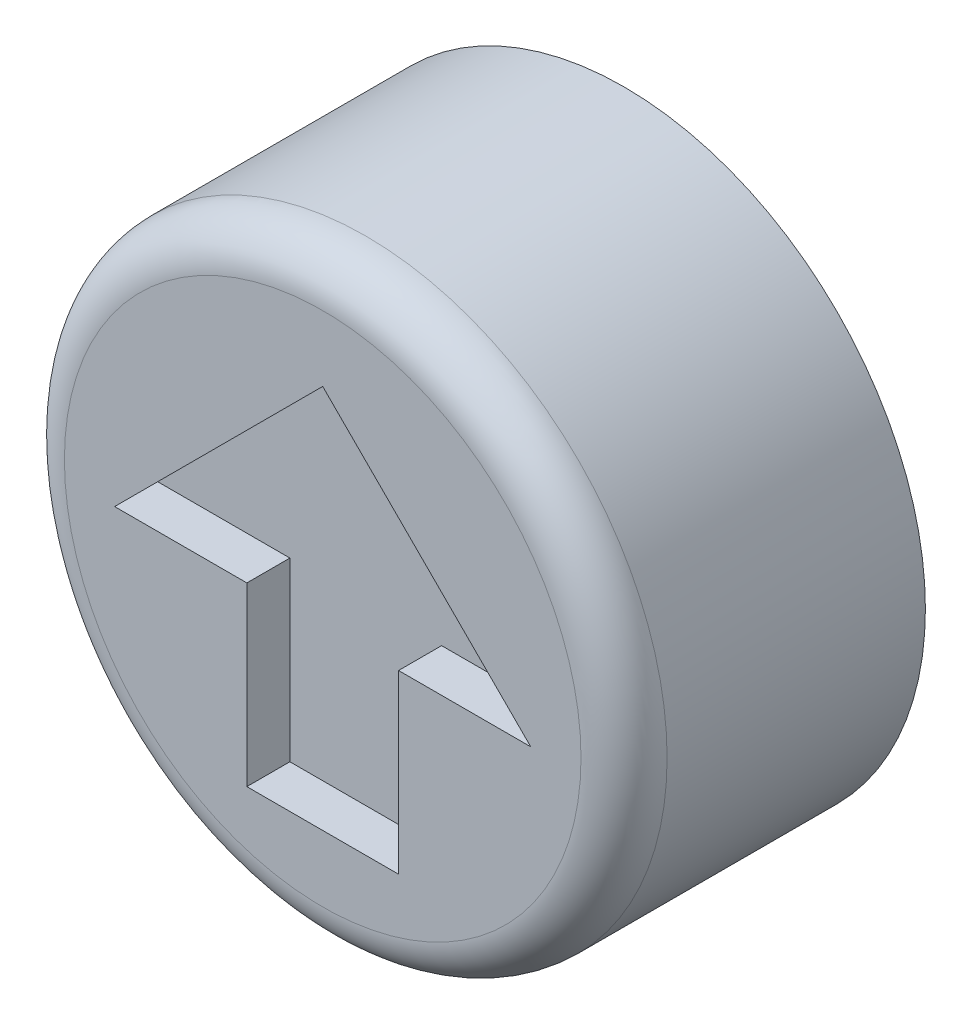
from build123d import *

# Parameters (mm, degrees)
SKETCH_1_R          = 7
SKETCH_1_R_2        = 1.6
EXTRUDE_1_DEPTH     = 5
SKETCH_2_R          = 7
EXTRUDE_2_DEPTH     = 2
FILLET_1_R          = 1
CUT_EXTRUDE_1_DEPTH = 1


with BuildPart() as part:
    # 草图1 → 凸台-拉伸1 (new body)
    with BuildSketch(Plane.XY):
        Circle(SKETCH_1_R)
        Circle(SKETCH_1_R_2, mode=Mode.SUBTRACT)
    extrude(amount=EXTRUDE_1_DEPTH)

    # 草图2 → 凸台-拉伸2 (add)
    with BuildSketch(Plane.XY.offset(5)):
        Circle(SKETCH_2_R)
    extrude(amount=EXTRUDE_2_DEPTH)

    # 圆角1
    fillet_1_edges = [part.edges().sort_by_distance(p)[0] for p in [
        (-7, 0, 7),
    ]]
    fillet(fillet_1_edges, radius=FILLET_1_R)

    # 草图4 → 切除-拉伸1 (cut)
    with BuildSketch(Plane.XY.offset(7)):
        Polygon((0, 4.472906985), (-4.833165044, -0.360258059), (-1.762054267, -0.360258059), (-1.762054267, -4.458639339), (1.762054267, -4.458639339), (1.762054267, -0.360258059), (4.833165044, -0.360258059), align=None)
    extrude(amount=-CUT_EXTRUDE_1_DEPTH, mode=Mode.SUBTRACT)


solid = part.part
